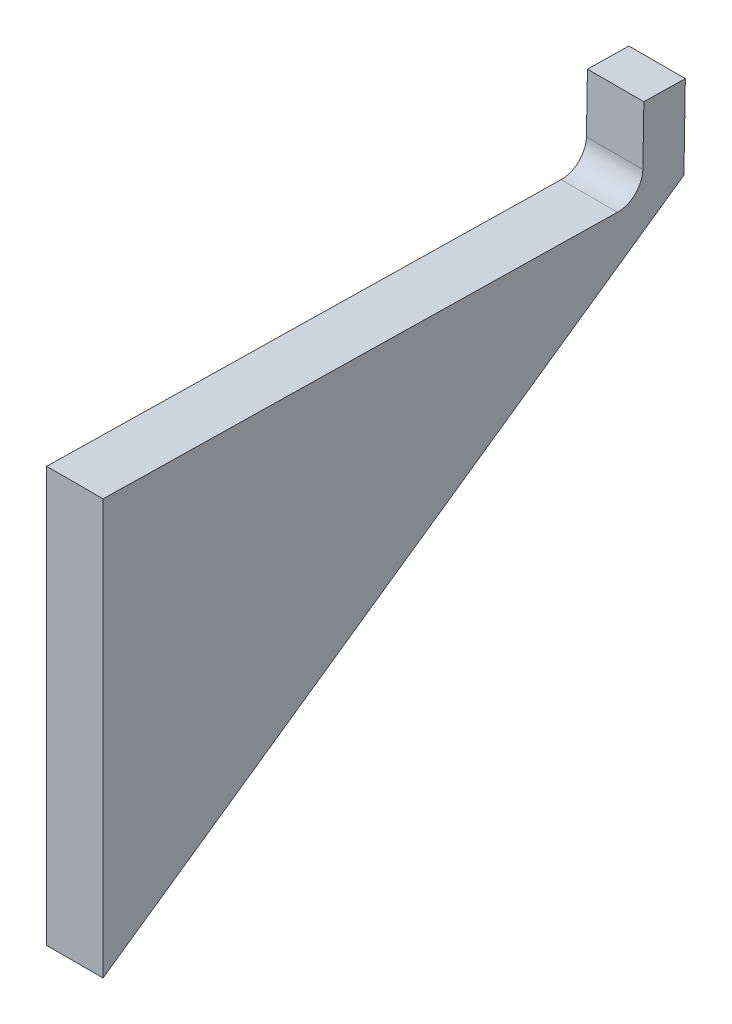
from build123d import *

# Parameters (mm, degrees)
SALIENTE_EXTRUIR1_DEPTH = 6.8


with BuildPart() as part:
    # Croquis1 → Saliente-Extruir1 (new body)
    with BuildSketch(Plane(origin=(0, 0, 0), x_dir=(0, 0, -1), z_dir=(1, 0, 0))):
        with BuildLine():
            Line((65.042457404, 1.865136667), (65.16462425, 8.864070533))
            Line((65.16462425, 8.864070533), (70.163862725, 8.776808501))
            Line((70.163862725, 8.776808501), (69.989338661, -1.221668451))
            Line((69.989338661, -1.221668451), (0, -50))
            Line((0, -50), (0, 0))
            Line((0, 0), (61.9905571, -1.082049199))
            ThreePointArc((61.9905571, -1.082049199), (64.12688943, -0.240525515), (65.042457404, 1.865136667))
        make_face()
    extrude(amount=SALIENTE_EXTRUIR1_DEPTH)


solid = part.part
